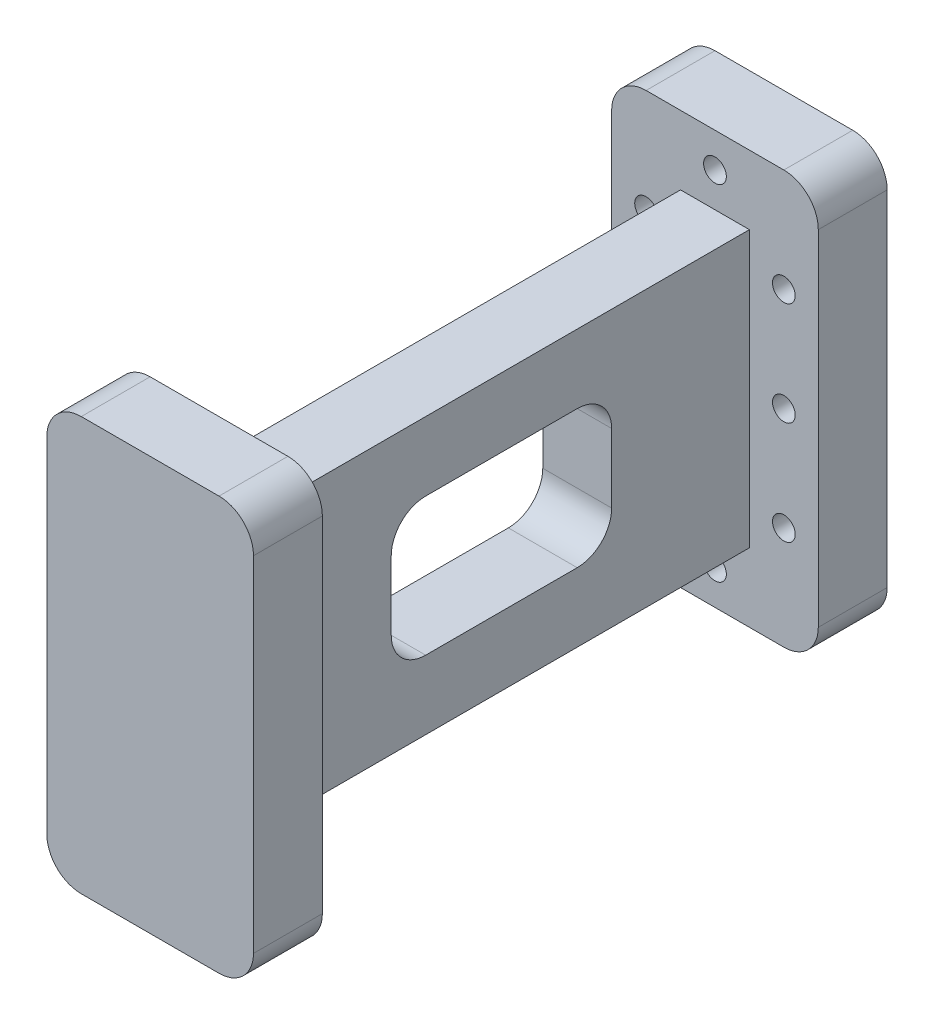
from build123d import *

# Parameters (mm, degrees)
BOSS_EXTRUDE1_DEPTH       = 92
CUT_EXTRUDE1_DEPTH        = 102.311401135
CUT_EXTRUDE1_DEPTH_BACK   = 10
SKETCH3_W                 = 72
SKETCH3_H                 = 50
CUT_EXTRUDE2_DEPTH        = 10
SKETCH4_W                 = 72
SKETCH4_H                 = 10
CUT_EXTRUDE3_DEPTH        = 10
SKETCH5_W                 = 72
SKETCH5_H                 = 10
CUT_EXTRUDE4_DEPTH        = 10
M4X0_7_TAPPED_HOLE1_D     = 3.3
M4X0_7_TAPPED_HOLE1_DEPTH = 10
M4X0_7_TAPPED_HOLE2_D     = 3.3
M4X0_7_TAPPED_HOLE2_DEPTH = 10
M4X0_7_TAPPED_HOLE3_D     = 3.3
M4X0_7_TAPPED_HOLE3_DEPTH = 10
M4X0_7_TAPPED_HOLE4_D     = 3.3
M4X0_7_TAPPED_HOLE4_DEPTH = 10
M4X0_7_TAPPED_HOLE5_D     = 3.3
M4X0_7_TAPPED_HOLE5_DEPTH = 10
M4X0_7_TAPPED_HOLE6_D     = 3.3
M4X0_7_TAPPED_HOLE6_DEPTH = 10
M4X0_7_TAPPED_HOLE7_D     = 3.3
M4X0_7_TAPPED_HOLE7_DEPTH = 10
M4X0_7_TAPPED_HOLE8_D     = 3.3
M4X0_7_TAPPED_HOLE8_DEPTH = 10
CUT_EXTRUDE5_DEPTH        = 10
CUT_EXTRUDE8_DEPTH        = 10
CUT_EXTRUDE9_DEPTH        = 10


with BuildPart() as part:
    # Sketch1 → Boss-Extrude1 (new body)
    with BuildSketch(Plane.XY):
        with BuildLine():
            Line((-10, -30), (10, -30))
            ThreePointArc((10, -30), (13.535533906, -28.535533906), (15, -25))
            Line((15, -25), (15, 25))
            ThreePointArc((15, 25), (13.535533906, 28.535533906), (10, 30))
            Line((10, 30), (-10, 30))
            ThreePointArc((-10, 30), (-13.535533906, 28.535533906), (-15, 25))
            Line((-15, 25), (-15, -25))
            ThreePointArc((-15, -25), (-13.535533906, -28.535533906), (-10, -30))
        make_face()
    extrude(amount=BOSS_EXTRUDE1_DEPTH)

    # Sketch2 → Cut-Extrude1 (cut, two sides: drawn at the far end of the back side and taken through both)
    with BuildSketch(Plane(origin=(15, 0, 0), x_dir=(0, 0, -1), z_dir=(1, 0, 0)).offset(-CUT_EXTRUDE1_DEPTH_BACK)):
        Polygon((-10, 25), (-82, 25), (-82, -25), (-10, -25), (-10, 0), align=None)
    extrude(amount=CUT_EXTRUDE1_DEPTH + CUT_EXTRUDE1_DEPTH_BACK, mode=Mode.SUBTRACT)

    # Sketch3 → Cut-Extrude2 (cut)
    with BuildSketch(Plane.ZY.offset(15)):
        with Locations((46, 0)):
            Rectangle(SKETCH3_W, SKETCH3_H)
    extrude(amount=-CUT_EXTRUDE2_DEPTH, mode=Mode.SUBTRACT)

    # Sketch4 → Cut-Extrude3 (cut)
    with BuildSketch(Plane.ZY.offset(5)):
        with Locations((46, 25)):
            Rectangle(SKETCH4_W, SKETCH4_H)
    extrude(amount=-CUT_EXTRUDE3_DEPTH, mode=Mode.SUBTRACT)

    # Sketch5 → Cut-Extrude4 (cut)
    with BuildSketch(Plane.ZY.offset(5)):
        with Locations((46, -25)):
            Rectangle(SKETCH5_W, SKETCH5_H)
    extrude(amount=-CUT_EXTRUDE4_DEPTH, mode=Mode.SUBTRACT)

    # M4x0.7 Tapped Hole1
    with Locations(Plane.XY.offset(10)):
        with Locations((10, -15)):
            Hole(M4X0_7_TAPPED_HOLE1_D / 2, depth=M4X0_7_TAPPED_HOLE1_DEPTH)

    # M4x0.7 Tapped Hole2
    with Locations(Plane.XY.offset(10)):
        with Locations((10, 0)):
            Hole(M4X0_7_TAPPED_HOLE2_D / 2, depth=M4X0_7_TAPPED_HOLE2_DEPTH)

    # M4x0.7 Tapped Hole3
    with Locations(Plane.XY.offset(10)):
        with Locations((10, 15)):
            Hole(M4X0_7_TAPPED_HOLE3_D / 2, depth=M4X0_7_TAPPED_HOLE3_DEPTH)

    # M4x0.7 Tapped Hole4
    with Locations(Plane.XY.offset(10)):
        with Locations((-10, -15)):
            Hole(M4X0_7_TAPPED_HOLE4_D / 2, depth=M4X0_7_TAPPED_HOLE4_DEPTH)

    # M4x0.7 Tapped Hole5
    with Locations(Plane.XY.offset(10)):
        with Locations((-10, 0)):
            Hole(M4X0_7_TAPPED_HOLE5_D / 2, depth=M4X0_7_TAPPED_HOLE5_DEPTH)

    # M4x0.7 Tapped Hole6
    with Locations(Plane.XY.offset(10)):
        with Locations((-10, 15)):
            Hole(M4X0_7_TAPPED_HOLE6_D / 2, depth=M4X0_7_TAPPED_HOLE6_DEPTH)

    # M4x0.7 Tapped Hole7
    with Locations(Plane.XY.offset(10)):
        with Locations((0, 25)):
            Hole(M4X0_7_TAPPED_HOLE7_D / 2, depth=M4X0_7_TAPPED_HOLE7_DEPTH)

    # M4x0.7 Tapped Hole8
    with Locations(Plane.XY.offset(10)):
        with Locations((0, -25)):
            Hole(M4X0_7_TAPPED_HOLE8_D / 2, depth=M4X0_7_TAPPED_HOLE8_DEPTH)

    # Sketch27 → Cut-Extrude5 (cut)
    with BuildSketch(Plane.ZY.offset(5)):
        with BuildLine():
            Line((62, 0), (62, 5))
            ThreePointArc((62, 5), (60.535533906, 8.535533906), (57, 10))
            Line((57, 10), (35, 10))
            ThreePointArc((35, 10), (31.464466094, 8.535533906), (30, 5))
            Line((30, 5), (30, 0))
            Line((30, 0), (30, -5))
            ThreePointArc((30, -5), (31.464466094, -8.535533906), (35, -10))
            Line((35, -10), (57, -10))
            ThreePointArc((57, -10), (60.535533906, -8.535533906), (62, -5))
            Line((62, -5), (62, 0))
        make_face()
    extrude(amount=-CUT_EXTRUDE5_DEPTH, mode=Mode.SUBTRACT)

    # Sketch29 → Cut-Extrude8 (cut)
    with BuildSketch(Plane.ZY.offset(15)):
        Polygon((82, -25), (82, 25), (82, 39.435498448), (10, 39.435498448), (10, -37.130826461), (82, -37.130826461), align=None)
    extrude(amount=-CUT_EXTRUDE8_DEPTH, mode=Mode.SUBTRACT)

    # Sketch30 → Cut-Extrude9 (cut)
    with BuildSketch(Plane(origin=(15, 0, 0), x_dir=(0, 0, -1), z_dir=(1, 0, 0))):
        Polygon((-82, 25), (-82, -25), (-82, -44.187859425), (-10, -44.187859425), (-10, -25), (-10, 35.921267628), (-82, 35.921267628), align=None)
    extrude(amount=-CUT_EXTRUDE9_DEPTH, mode=Mode.SUBTRACT)


solid = part.part
